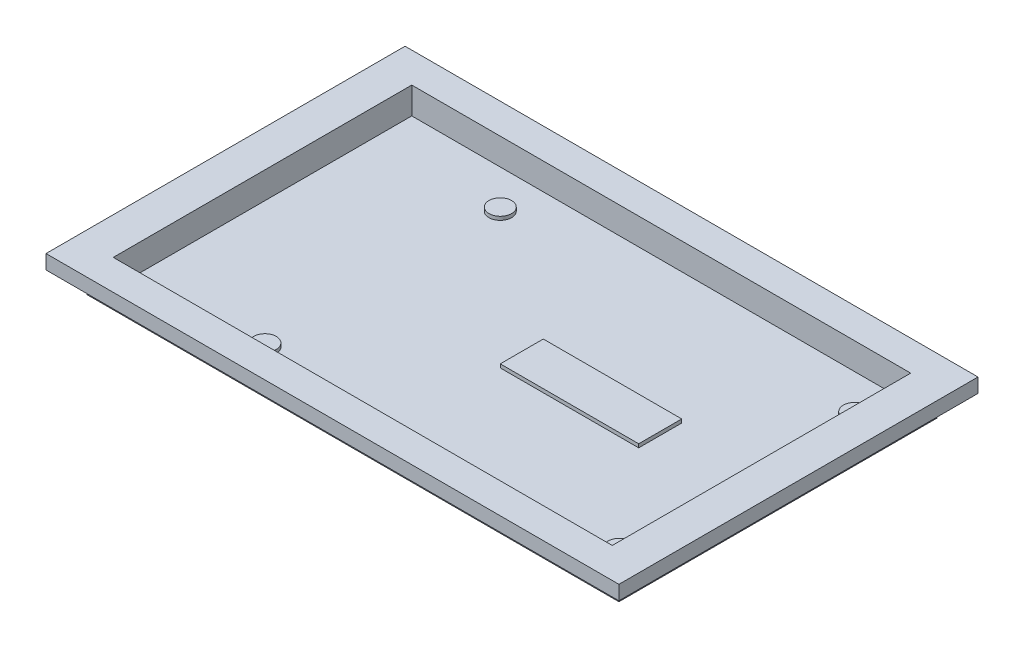
from build123d import *

# Parameters (mm, degrees)
SKETCH1_W              = 64.3
SKETCH1_H              = 40.3
BOSS_EXTRUDE1_DEPTH    = 4
SKETCH2_W              = 56
SKETCH2_H              = 33.5
MAIN_WELL_CUTOUT_DEPTH = 3
SKETCH8_R              = 1.27
SKETCH8_W              = 15.536
SKETCH8_H              = 4.826
ADHESIVE_CONTACT_DEPTH = 0.4
SKETCH5_W              = 59.7
SKETCH5_H              = 2.4
CUT_EXTRUDE2_DEPTH     = 2.3
SKETCH5_3_W            = 2.3
SKETCH5_3_H            = 2.4
CUT_EXTRUDE3_DEPTH     = 76.99065732


with BuildPart() as part:
    # Sketch1 → Boss-Extrude1 (new body)
    with BuildSketch(Plane(origin=(0, 0, 0), x_dir=(1, 0, 0), z_dir=(0, 1, 0))):
        with Locations((32.15, 20.15)):
            Rectangle(SKETCH1_W, SKETCH1_H)
    extrude(amount=BOSS_EXTRUDE1_DEPTH)

    # Sketch2 → main well cutout (cut)
    with BuildSketch(Plane(origin=(0, 4, 0), x_dir=(1, 0, 0), z_dir=(0, 1, 0))):
        with Locations((32.15, 20.15)):
            Rectangle(SKETCH2_W, SKETCH2_H)
    extrude(amount=-MAIN_WELL_CUTOUT_DEPTH, mode=Mode.SUBTRACT)

    # Sketch8 → Adhesive contact (add)
    with BuildSketch(Plane(origin=(0, 1, 0), x_dir=(1, 0, 0), z_dir=(0, 1, 0))):
        with Locations((18.374, 32.61)):
            Circle(SKETCH8_R)
        with Locations((18.374, 6.194)):
            Circle(SKETCH8_R)
        with Locations((58.15, 6.194)):
            Circle(SKETCH8_R)
        with Locations((58.15, 32.61)):
            Circle(SKETCH8_R)
        with Locations((41.382, 19.783)):
            Rectangle(SKETCH8_W, SKETCH8_H)
    extrude(amount=ADHESIVE_CONTACT_DEPTH)

    # Sketch5 → Cut-Extrude2 (cut)
    with BuildSketch(Plane.XY):
        with Locations((32.15, 1.2)):
            Rectangle(SKETCH5_W, SKETCH5_H)
    cut_extrude2 = extrude(amount=-CUT_EXTRUDE2_DEPTH, mode=Mode.SUBTRACT)

    # Sketch5<3> → Cut-Extrude3 (cut, through all)
    with BuildSketch(Plane.XY):
        with Locations((1.15, 1.2)):
            Rectangle(SKETCH5_3_W, SKETCH5_3_H)
        with Locations((63.15, 1.2)):
            Rectangle(SKETCH5_3_W, SKETCH5_3_H)
    extrude(amount=-CUT_EXTRUDE3_DEPTH, mode=Mode.SUBTRACT)

    # cuttout mirror: Cut-Extrude2 across plane
    add(cut_extrude2.mirror(Plane.XY.offset(-20.15)), mode=Mode.SUBTRACT)


solid = part.part
